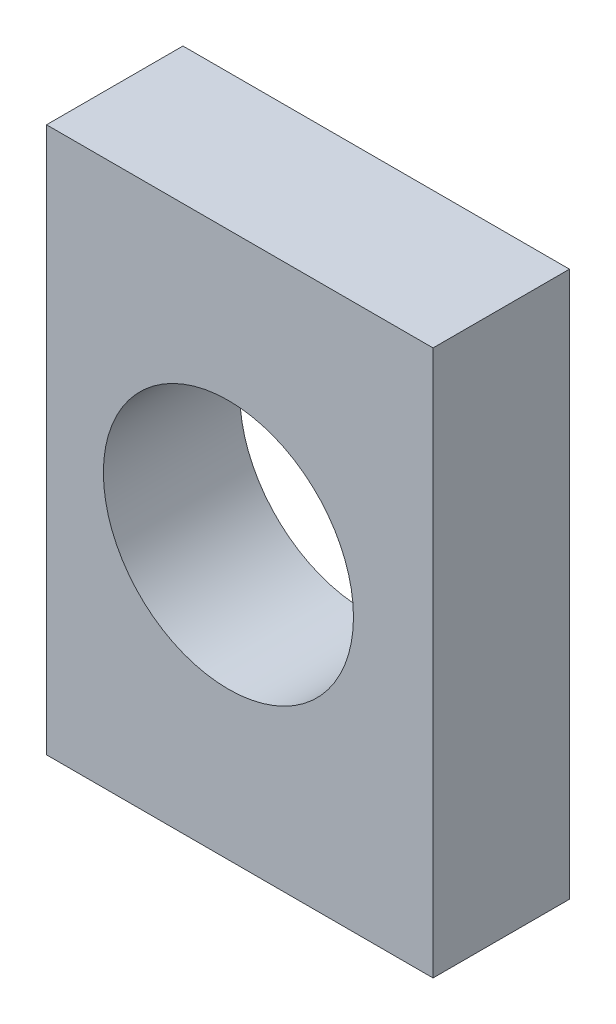
from build123d import *

# Parameters (mm, degrees)
M5_ATTACHMENT_PROFILE_W = 8.5
M5_ATTACHMENT_PROFILE_H = 12
M5_ATTACHMENT_PROFILE_R = 2.75
M5_ATTACHMENT_DEPTH     = 3


with BuildPart() as part:
    # M5 attachment profile → M5 attachment (new body)
    with BuildSketch(Plane.XY):
        with Locations((98.75, 0)):
            Rectangle(M5_ATTACHMENT_PROFILE_W, M5_ATTACHMENT_PROFILE_H)
        with Locations((98.5, 0)):
            Circle(M5_ATTACHMENT_PROFILE_R, mode=Mode.SUBTRACT)
    extrude(amount=M5_ATTACHMENT_DEPTH)


solid = part.part
